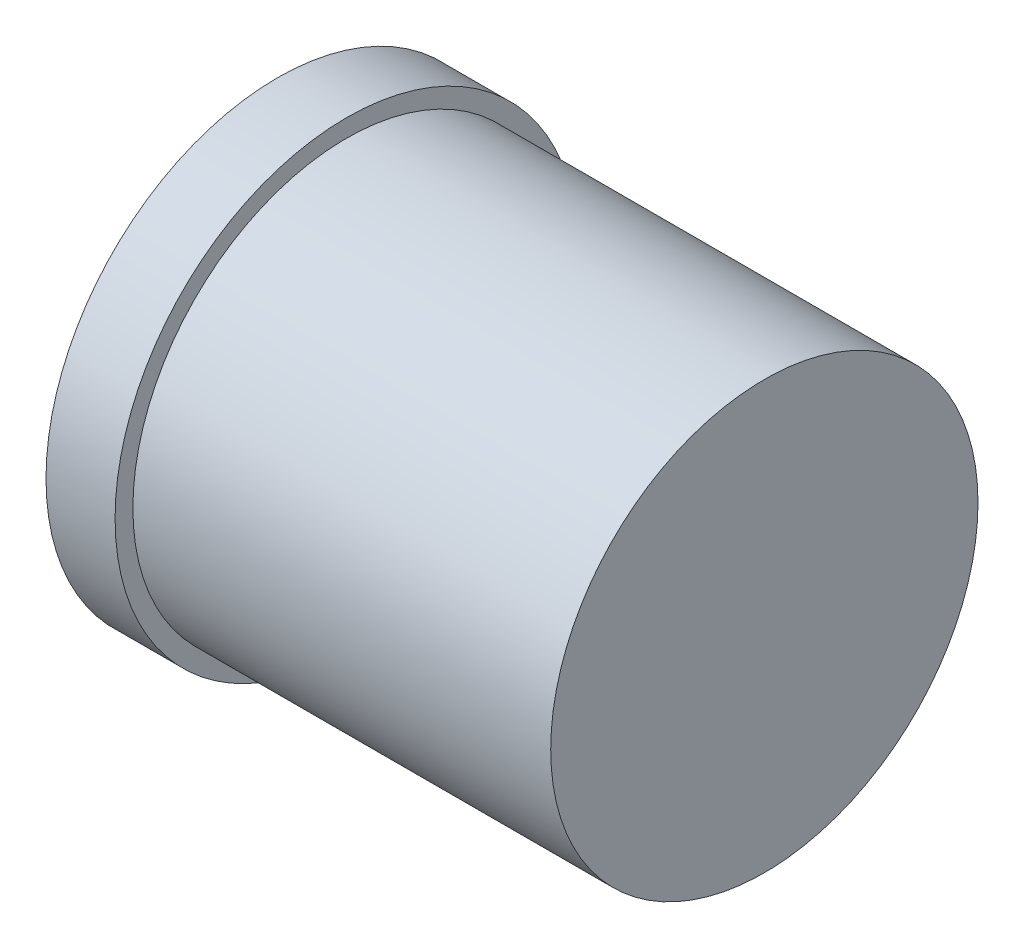
from build123d import *

# Parameters (mm, degrees)
SKETCH1_R            = 38.1
SKETCH1_R_2          = 27.727172307
BOSS_EXTRUDE1_DEPTH  = 26.9875
BOSS_EXTRUDE2_START  = 5.5118
SKETCH2_R            = 38.1
SKETCH2_R_2          = 22.0345
BOSS_EXTRUDE2_DEPTH  = 5.5118
SKETCH3_R            = 38.1
SKETCH3_R_2          = 22.0345
BOSS_EXTRUDE3_DEPTH  = 26.9875
BOSS_EXTRUDE4_DEPTH  = 2.3876
BOSS_EXTRUDE5_START  = 2.2098
SKETCH5_R            = 38.1
SKETCH5_R_2          = 17.526
BOSS_EXTRUDE5_DEPTH  = 2.2098
SKETCH7_R            = 24.60625
CUT_EXTRUDE1_DEPTH   = 1.778
SKETCH8_R            = 38.1
SKETCH8_R_2          = 6.5151
BOSS_EXTRUDE6_DEPTH  = 5.969
SKETCH9_R            = 38.1
SKETCH9_R_2          = 5.0165
BOSS_EXTRUDE7_DEPTH  = 5.2578
SKETCH10_R           = 38.1
BOSS_EXTRUDE8_DEPTH  = 1.5875
BOSS_EXTRUDE9_REACH  = 74.802
SKETCH12_R           = 41.275
SKETCH12_R_2         = 31.75
BOSS_EXTRUDE10_DEPTH = 12.319


with BuildPart() as part:
    # Sketch1 → Boss-Extrude1 (new body)
    with BuildSketch(Plane(origin=(0, 0, 0), x_dir=(0, 0, -1), z_dir=(1, 0, 0))):
        Circle(SKETCH1_R)
        Circle(SKETCH1_R_2, mode=Mode.SUBTRACT)
    extrude(amount=BOSS_EXTRUDE1_DEPTH)

    # Sketch2 → Boss-Extrude2 (add)
    with BuildSketch(Plane.ZY.offset(BOSS_EXTRUDE2_START)):
        Circle(SKETCH2_R)
        Circle(SKETCH2_R_2, mode=Mode.SUBTRACT)
    extrude(amount=-BOSS_EXTRUDE2_DEPTH)

    # Sketch3 → Boss-Extrude3 (add)
    with BuildSketch(Plane(origin=(26.9875, 0, 0), x_dir=(0, 0, -1), z_dir=(1, 0, 0))):
        with Locations(Location((0, 0, 0), (0, 0, 180))):
            Circle(SKETCH3_R)
        with Locations(Location((0, 0, 0), (0, 0, 180))):
            Circle(SKETCH3_R_2, mode=Mode.SUBTRACT)
    extrude(amount=BOSS_EXTRUDE3_DEPTH)

    # Sketch4 → Boss-Extrude4 (add)
    with BuildSketch(Plane(origin=(0, 0, 0), x_dir=(0, 0, -1), z_dir=(1, 0, 0))):
        with BuildLine():
            Line((-2.1336, 21.930958513), (-2.1336, 27.727172307))
            Line((-2.1336, 27.727172307), (2.1336, 27.727172307))
            Line((2.1336, 27.727172307), (2.1336, 21.930958513))
            ThreePointArc((2.1336, 21.930958513), (0, 22.0345), (-2.1336, 21.930958513))
        make_face()
    boss_extrude4 = extrude(amount=BOSS_EXTRUDE4_DEPTH)

    # Mirror1: Boss-Extrude4 across plane
    add(boss_extrude4.mirror(Plane.ZX))

    # Sketch5 → Boss-Extrude5 (add)
    with BuildSketch(Plane.ZY.offset(5.5118).offset(BOSS_EXTRUDE5_START)):
        Circle(SKETCH5_R)
        Circle(SKETCH5_R_2, mode=Mode.SUBTRACT)
    extrude(amount=-BOSS_EXTRUDE5_DEPTH)

    # Sketch7 → Cut-Extrude1 (cut)
    with BuildSketch(Plane.ZY.offset(-39.4589)):
        Circle(SKETCH7_R)
    extrude(amount=-CUT_EXTRUDE1_DEPTH, mode=Mode.SUBTRACT)

    # Sketch8 → Boss-Extrude6 (add)
    with BuildSketch(Plane(origin=(53.975, 0, 0), x_dir=(0, 0, -1), z_dir=(1, 0, 0))):
        with Locations(Location((0, 0, 0), (0, 0, 180))):
            Circle(SKETCH8_R)
        Circle(SKETCH8_R_2, mode=Mode.SUBTRACT)
    extrude(amount=BOSS_EXTRUDE6_DEPTH)

    # Sketch9 → Boss-Extrude7 (add)
    with BuildSketch(Plane(origin=(59.944, 0, 0), x_dir=(0, 0, -1), z_dir=(1, 0, 0))):
        with Locations(Location((0, 0, 0), (0, 0, 180))):
            Circle(SKETCH9_R)
        Circle(SKETCH9_R_2, mode=Mode.SUBTRACT)
    extrude(amount=BOSS_EXTRUDE7_DEPTH)

    # Sketch10 → Boss-Extrude8 (add)
    with BuildSketch(Plane(origin=(65.2018, 0, 0), x_dir=(0, 0, -1), z_dir=(1, 0, 0))):
        with Locations(Location((0, 0, 0), (0, 0, 180))):
            Circle(SKETCH10_R)
    extrude(amount=BOSS_EXTRUDE8_DEPTH)

    # Sketch11 → Boss-Extrude9 (add, up to next)
    with BuildSketch(Plane.ZY.offset(-41.2369), mode=Mode.PRIVATE) as boss_extrude9_sk1:
        with BuildLine():
            Line((1.8034, -21.960576921), (1.8034, -24.60625))
            Line((1.8034, -24.60625), (-1.8034, -24.60625))
            Line((-1.8034, -24.60625), (-1.8034, -21.960576921))
            ThreePointArc((-1.8034, -21.960576921), (0, -22.0345), (1.8034, -21.960576921))
        make_face()
    boss_extrude9_tool1 = extrude(boss_extrude9_sk1.sketch, amount=BOSS_EXTRUDE9_REACH, mode=Mode.PRIVATE) - part.part
    boss_extrude9 = boss_extrude9_tool1.solids().sort_by_distance((41.2369, -23.307969, 0))[0]
    add(boss_extrude9)

    # Mirror2: Boss-Extrude9 across plane
    add(boss_extrude9.mirror(Plane.ZX))

    # Sketch12 → Boss-Extrude10 (add)
    with BuildSketch(Plane.ZY.offset(7.7216)):
        with Locations(Location((0, 0, 0), (0, 0, 180))):
            Circle(SKETCH12_R)
        with Locations(Location((0, 0, 0), (0, 0, 180))):
            Circle(SKETCH12_R_2, mode=Mode.SUBTRACT)
    extrude(amount=BOSS_EXTRUDE10_DEPTH)


solid = part.part
